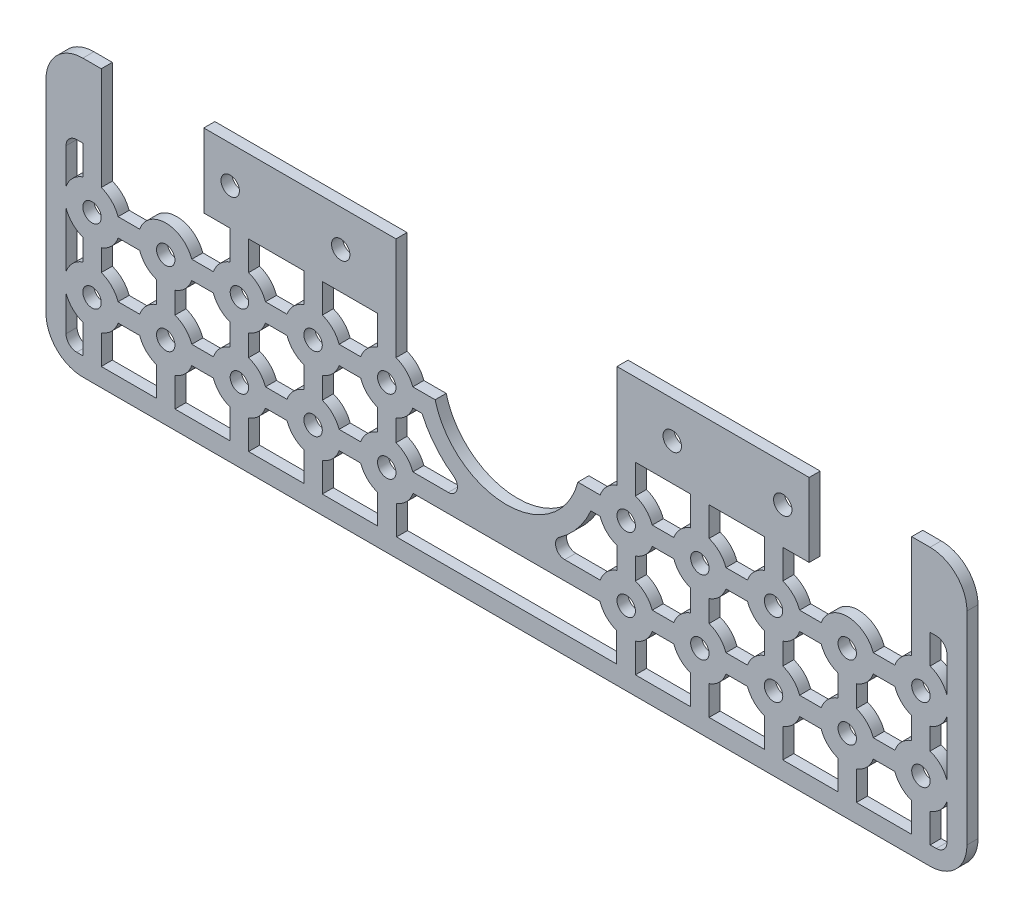
from build123d import *

# Parameters (mm, degrees)
SKETCH1_R           = 5
BOSS_EXTRUDE1_DEPTH = 6


with BuildPart() as part:
    # Sketch1 → Boss-Extrude1 (new body)
    with BuildSketch(Plane.XY):
        with BuildLine():
            Line((-250, -55), (-250, 55))
            ThreePointArc((-250, 55), (-244.142135624, 69.142135624), (-230, 75))
            Line((-230, 75), (-220, 75))
            Line((-220, 75), (-220, 19.142135624))
            ThreePointArc((-220, 19.142135624), (-214.393398282, 15.606601718), (-210.857864376, 10))
            Line((-210.857864376, 10), (-199.142135624, 10))
            ThreePointArc((-199.142135624, 10), (-195.606601718, 15.606601718), (-190, 19.142135624))
            ThreePointArc((-190, 19.142135624), (-185, 20), (-180, 19.142135624))
            ThreePointArc((-180, 19.142135624), (-174.393398282, 15.606601718), (-170.857864376, 10))
            Line((-170.857864376, 10), (-159.142135624, 10))
            ThreePointArc((-159.142135624, 10), (-155.606601718, 15.606601718), (-150, 19.142135624))
            Line((-150, 19.142135624), (-150, 35))
            Line((-150, 35), (-164.330865428, 35))
            Line((-164.330865428, 35), (-164.330865428, 75))
            Line((-164.330865428, 75), (-60, 75))
            Line((-60, 75), (-60, 35))
            Line((-60, 35), (-60, 19.142135624))
            ThreePointArc((-60, 19.142135624), (-54.393398282, 15.606601718), (-50.857864376, 10))
            Line((-50.857864376, 10), (-48.989794856, 10))
            Line((-48.989794856, 10), (-38.729833462, 10))
            ThreePointArc((-38.729833462, 10), (-24.494897428, -11.622776602), (0, -20))
            Line((0, -20), (0, -40))
            Line((0, -40), (-50.702530301, -40))
            ThreePointArc((-50.702530301, -40), (-54.177246742, -45.596492425), (-59.699088625, -49.18865668))
            Line((-59.699088625, -49.18865668), (-59.699088625, -65))
            Line((-59.699088625, -65), (0, -65))
            Line((0, -65), (0, -75))
            Line((0, -75), (-230, -75))
            ThreePointArc((-230, -75), (-244.142135624, -69.142135624), (-250, -55))
        make_face()
        with Locations((-150, 55)):
            Circle(SKETCH1_R, mode=Mode.SUBTRACT)
        with Locations((-90, 55)):
            Circle(SKETCH1_R, mode=Mode.SUBTRACT)
        with Locations((-225, 5)):
            Circle(SKETCH1_R, mode=Mode.SUBTRACT)
        with Locations(Location((-225, -35, 0), (0, 0, 180))):
            Circle(SKETCH1_R, mode=Mode.SUBTRACT)
        with Locations((-185, 5)):
            Circle(SKETCH1_R, mode=Mode.SUBTRACT)
        with Locations(Location((-185, -35, 0), (0, 0, 180))):
            Circle(SKETCH1_R, mode=Mode.SUBTRACT)
        with Locations((-145, 5)):
            Circle(SKETCH1_R, mode=Mode.SUBTRACT)
        with Locations(Location((-145, -35, 0), (0, 0, 180))):
            Circle(SKETCH1_R, mode=Mode.SUBTRACT)
        with Locations((-105, 5)):
            Circle(SKETCH1_R, mode=Mode.SUBTRACT)
        with Locations(Location((-105, -35, 0), (0, 0, 180))):
            Circle(SKETCH1_R, mode=Mode.SUBTRACT)
        with Locations((-65, 5)):
            Circle(SKETCH1_R, mode=Mode.SUBTRACT)
        with Locations(Location((-65, -35, 0), (0, 0, 180))):
            Circle(SKETCH1_R, mode=Mode.SUBTRACT)
        with BuildLine():
            Line((-239.142135624, 10), (-239.142135624, 29.209308615))
            ThreePointArc((-239.142135624, 29.209308615), (-237.446081385, 33.303945761), (-233.351444239, 35))
            Line((-233.351444239, 35), (-230, 35))
            Line((-230, 35), (-230, 19.142135624))
            ThreePointArc((-230, 19.142135624), (-235.606601718, 15.606601718), (-239.142135624, 10))
        make_face(mode=Mode.SUBTRACT)
        with BuildLine():
            Line((-239.142135624, 0), (-239.142135624, -30))
            ThreePointArc((-239.142135624, -30), (-235.606601718, -24.393398282), (-230, -20.857864376))
            Line((-230, -20.857864376), (-230, -9.142135624))
            ThreePointArc((-230, -9.142135624), (-235.606601718, -5.606601718), (-239.142135624, 0))
        make_face(mode=Mode.SUBTRACT)
        with BuildLine():
            Line((-239.142135624, -40), (-239.142135624, -59.167507998))
            ThreePointArc((-239.142135624, -59.167507998), (-237.446081385, -63.262145144), (-233.351444239, -64.958199383))
            Line((-233.351444239, -64.958199383), (-230, -64.958199383))
            Line((-230, -64.958199383), (-230, -49.142135624))
            ThreePointArc((-230, -49.142135624), (-235.606601718, -45.606601718), (-239.142135624, -40))
        make_face(mode=Mode.SUBTRACT)
        with BuildLine():
            Line((-220, -9.142135624), (-220, -20.857864376))
            ThreePointArc((-220, -20.857864376), (-214.393398282, -24.393398282), (-210.857864376, -30))
            Line((-210.857864376, -30), (-199.142135624, -30))
            ThreePointArc((-199.142135624, -30), (-195.606601718, -24.393398282), (-190, -20.857864376))
            Line((-190, -20.857864376), (-190, -9.142135624))
            ThreePointArc((-190, -9.142135624), (-195.606601718, -5.606601718), (-199.142135624, 0))
            Line((-199.142135624, 0), (-210.857864376, 0))
            ThreePointArc((-210.857864376, 0), (-214.393398282, -5.606601718), (-220, -9.142135624))
        make_face(mode=Mode.SUBTRACT)
        with BuildLine():
            Line((-220, -49.142135624), (-220, -65))
            Line((-220, -65), (-190, -65))
            Line((-190, -65), (-190, -49.142135624))
            ThreePointArc((-190, -49.142135624), (-195.606601718, -45.606601718), (-199.142135624, -40))
            Line((-199.142135624, -40), (-210.857864376, -40))
            ThreePointArc((-210.857864376, -40), (-214.393398282, -45.606601718), (-220, -49.142135624))
        make_face(mode=Mode.SUBTRACT)
        with BuildLine():
            Line((-180, -9.142135624), (-180, -20.857864376))
            ThreePointArc((-180, -20.857864376), (-174.393398282, -24.393398282), (-170.857864376, -30))
            Line((-170.857864376, -30), (-159.142135624, -30))
            ThreePointArc((-159.142135624, -30), (-155.606601718, -24.393398282), (-150, -20.857864376))
            Line((-150, -20.857864376), (-150, -9.142135624))
            ThreePointArc((-150, -9.142135624), (-155.606601718, -5.606601718), (-159.142135624, 0))
            Line((-159.142135624, 0), (-170.857864376, 0))
            ThreePointArc((-170.857864376, 0), (-174.393398282, -5.606601718), (-180, -9.142135624))
        make_face(mode=Mode.SUBTRACT)
        with BuildLine():
            Line((-180, -49.142135624), (-180, -65))
            Line((-180, -65), (-150, -65))
            Line((-150, -65), (-150, -49.142135624))
            ThreePointArc((-150, -49.142135624), (-155.606601718, -45.606601718), (-159.142135624, -40))
            Line((-159.142135624, -40), (-170.857864376, -40))
            ThreePointArc((-170.857864376, -40), (-174.393398282, -45.606601718), (-180, -49.142135624))
        make_face(mode=Mode.SUBTRACT)
        with BuildLine():
            Line((-140, 19.142135624), (-140, 35))
            Line((-140, 35), (-110, 35))
            Line((-110, 35), (-110, 19.142135624))
            ThreePointArc((-110, 19.142135624), (-115.606601718, 15.606601718), (-119.142135624, 10))
            Line((-119.142135624, 10), (-130.857864376, 10))
            ThreePointArc((-130.857864376, 10), (-134.393398282, 15.606601718), (-140, 19.142135624))
        make_face(mode=Mode.SUBTRACT)
        with BuildLine():
            Line((-140, -9.142135624), (-140, -20.857864376))
            ThreePointArc((-140, -20.857864376), (-134.393398282, -24.393398282), (-130.857864376, -30))
            Line((-130.857864376, -30), (-119.142135624, -30))
            ThreePointArc((-119.142135624, -30), (-115.606601718, -24.393398282), (-110, -20.857864376))
            Line((-110, -20.857864376), (-110, -9.142135624))
            ThreePointArc((-110, -9.142135624), (-115.606601718, -5.606601718), (-119.142135624, 0))
            Line((-119.142135624, 0), (-130.857864376, 0))
            ThreePointArc((-130.857864376, 0), (-134.393398282, -5.606601718), (-140, -9.142135624))
        make_face(mode=Mode.SUBTRACT)
        with BuildLine():
            Line((-140, -49.142135624), (-140, -65))
            Line((-140, -65), (-110, -65))
            Line((-110, -65), (-110, -49.142135624))
            ThreePointArc((-110, -49.142135624), (-115.606601718, -45.606601718), (-119.142135624, -40))
            Line((-119.142135624, -40), (-130.857864376, -40))
            ThreePointArc((-130.857864376, -40), (-134.393398282, -45.606601718), (-140, -49.142135624))
        make_face(mode=Mode.SUBTRACT)
        with BuildLine():
            Line((-100, 19.142135624), (-100, 35))
            Line((-100, 35), (-70, 35))
            Line((-70, 35), (-70, 19.142135624))
            ThreePointArc((-70, 19.142135624), (-75.606601718, 15.606601718), (-79.142135624, 10))
            Line((-79.142135624, 10), (-90.857864376, 10))
            ThreePointArc((-90.857864376, 10), (-94.393398282, 15.606601718), (-100, 19.142135624))
        make_face(mode=Mode.SUBTRACT)
        with BuildLine():
            Line((-100, -9.142135624), (-100, -20.857864376))
            ThreePointArc((-100, -20.857864376), (-94.393398282, -24.393398282), (-90.857864376, -30))
            Line((-90.857864376, -30), (-79.142135624, -30))
            ThreePointArc((-79.142135624, -30), (-75.606601718, -24.393398282), (-70, -20.857864376))
            Line((-70, -20.857864376), (-70, -9.142135624))
            ThreePointArc((-70, -9.142135624), (-75.606601718, -5.606601718), (-79.142135624, 0))
            Line((-79.142135624, 0), (-90.857864376, 0))
            ThreePointArc((-90.857864376, 0), (-94.393398282, -5.606601718), (-100, -9.142135624))
        make_face(mode=Mode.SUBTRACT)
        with BuildLine():
            Line((-100, -49.142135624), (-100, -65))
            Line((-100, -65), (-70, -65))
            Line((-70, -65), (-70, -49.142135624))
            ThreePointArc((-70, -49.142135624), (-75.606601718, -45.606601718), (-79.142135624, -40))
            Line((-79.142135624, -40), (-90.857864376, -40))
            ThreePointArc((-90.857864376, -40), (-94.393398282, -45.606601718), (-100, -49.142135624))
        make_face(mode=Mode.SUBTRACT)
        with BuildLine():
            Line((-60, -9.142135624), (-60, -20.857864376))
            ThreePointArc((-60, -20.857864376), (-54.393398282, -24.393398282), (-50.857864376, -30))
            Line((-50.857864376, -30), (-31.622776602, -30))
            ThreePointArc((-31.622776602, -30), (-26.855463655, -26.507556723), (-28.747978729, -20.909090909))
            ThreePointArc((-28.747978729, -20.909090909), (-38.724772871, -11.628973522), (-45.82575695, 0))
            Line((-45.82575695, 0), (-50.857864376, 0))
            ThreePointArc((-50.857864376, 0), (-54.393398282, -5.606601718), (-60, -9.142135624))
        make_face(mode=Mode.SUBTRACT)
    boss_extrude1 = extrude(amount=BOSS_EXTRUDE1_DEPTH)

    # Mirror1: Boss-Extrude1 across plane
    add(boss_extrude1.mirror(Plane(origin=(0, -20, 6), x_dir=(0, 0, 1), z_dir=(-1, 0, 0))))


solid = part.part
